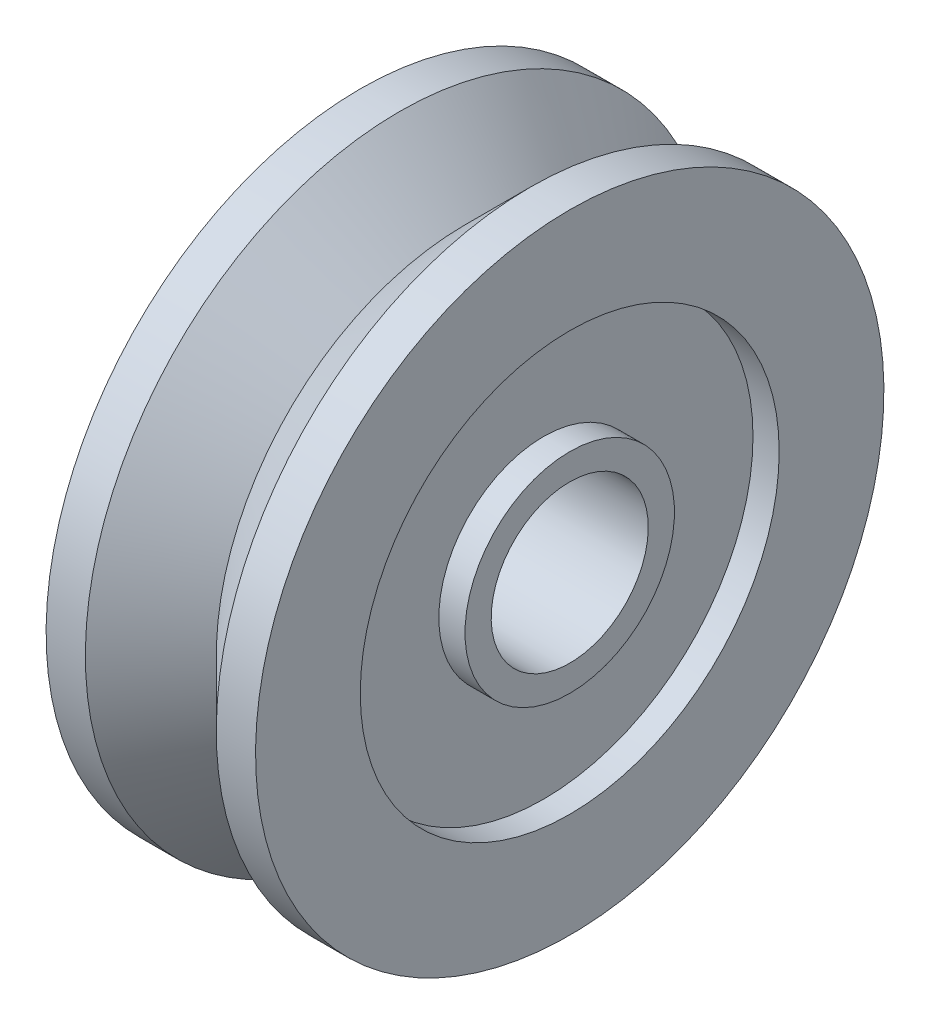
from build123d import *


with BuildPart() as part:
    # Szkic1 → Obrót1 (revolve)
    with BuildSketch(Plane.XY):
        Polygon((0, 4.75), (-1.25, 6), (-2, 6), (-2, 4), (-1.5, 4), (-1.5, 2), (-2, 2), (-2, 1.5), (2, 1.5), (2, 2), (1.5, 2), (1.5, 4), (2, 4), (2, 6), (1.25, 6), align=None)
    revolve(axis=Axis((0, 0, 0), (-1, 0, 0)))


solid = part.part
